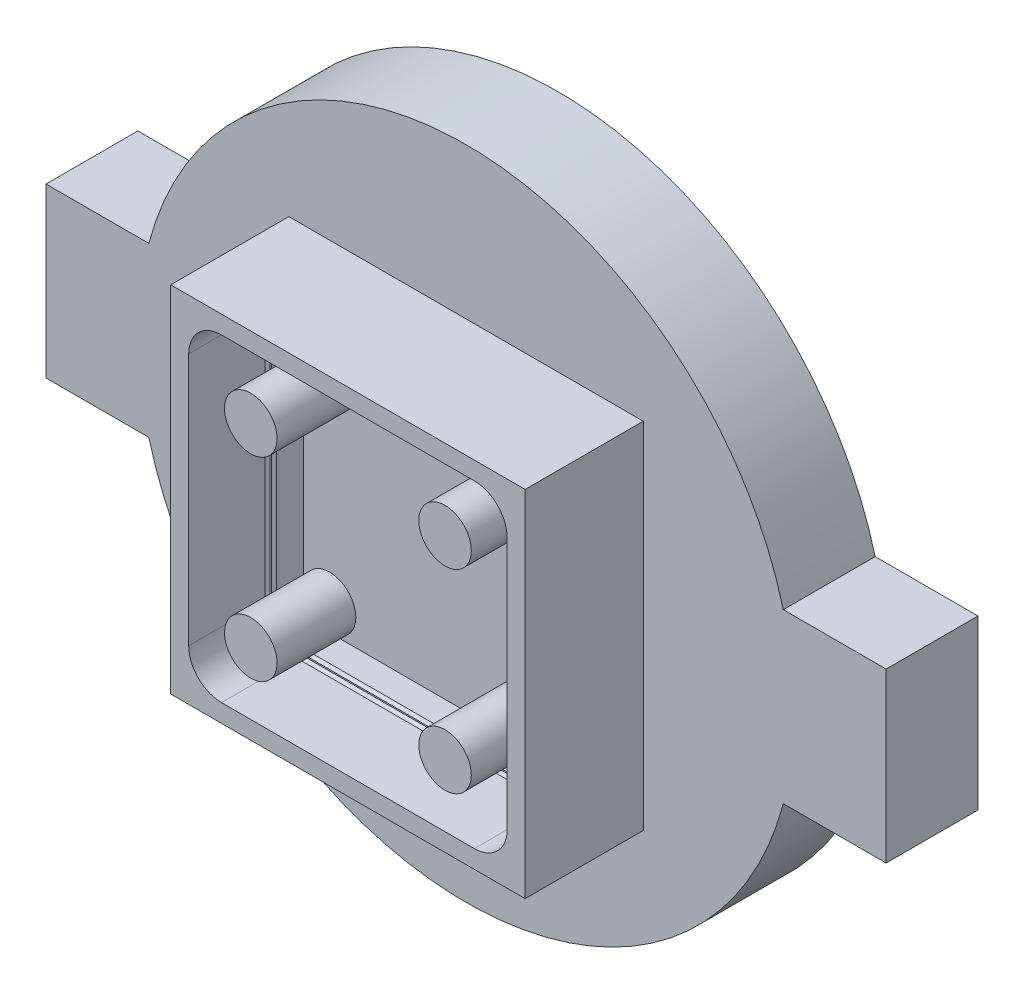
from build123d import *

# Parameters (mm, degrees)
SKETCH1_R           = 17.5
BOSS_EXTRUDE1_DEPTH = 3
SKETCH2_R           = 17.5
BOSS_EXTRUDE2_DEPTH = 0.5
SKETCH3_W           = 13.5
SKETCH3_H           = 13.5
SKETCH3_W_2         = 11.63
SKETCH3_H_2         = 11.63
SKETCH3_W_3         = 9.4
SKETCH3_H_3         = 9.4
BOSS_EXTRUDE3_DEPTH = 1.5
FILLET1_R           = 1
SKETCH4_R           = 17.5
CUT_EXTRUDE1_DEPTH  = 32.5
BOSS_EXTRUDE4_START = 3
SKETCH5_R           = 1
BOSS_EXTRUDE4_DEPTH = 3
SKETCH6_W           = 13.5
SKETCH6_H           = 13.5
BOSS_EXTRUDE6_DEPTH = 3
CHAMFER1_SIZE       = 0.1


with BuildPart() as part:
    # Sketch1 → Boss-Extrude1 (new body)
    with BuildSketch(Plane.XY):
        Circle(SKETCH1_R)
        with BuildLine():
            Line((-9.921567416, -1.25), (-14.021567416, -1.25))
            Line((-14.021567416, -1.25), (-14.021567416, 1.25))
            Line((-14.021567416, 1.25), (-9.921567416, 1.25))
            ThreePointArc((-9.921567416, 1.25), (0, 10), (9.921567416, 1.25))
            Line((9.921567416, 1.25), (14.021567416, 1.25))
            Line((14.021567416, 1.25), (14.021567416, -1.25))
            Line((14.021567416, -1.25), (9.921567416, -1.25))
            ThreePointArc((9.921567416, -1.25), (0, -10), (-9.921567416, -1.25))
        make_face(mode=Mode.SUBTRACT)
    extrude(amount=BOSS_EXTRUDE1_DEPTH)

    # Sketch2 → Boss-Extrude2 (add)
    with BuildSketch(Plane.XY.offset(3)):
        Circle(SKETCH2_R)
    extrude(amount=BOSS_EXTRUDE2_DEPTH)

    # Sketch3 → Boss-Extrude3 (add)
    # profile 1 of 2: a face of its own
    with BuildSketch(Plane.XY.offset(3.5)):
        Rectangle(SKETCH3_W, SKETCH3_H)
        Rectangle(SKETCH3_W_2, SKETCH3_H_2, mode=Mode.SUBTRACT)
    # profile 2 of 2: a face of its own
    with BuildSketch(Plane.XY.offset(3.5)):
        Rectangle(SKETCH3_W_3, SKETCH3_H_3)
    extrude(amount=BOSS_EXTRUDE3_DEPTH)

    # Fillet1
    fillet1_edges = [part.edges().sort_by_distance(p)[0] for p in [
        (4.7, 4.7, 4.25),
        (-4.7, 4.7, 4.25),
        (-4.7, -4.7, 4.25),
        (4.7, -4.7, 4.25),
        (5.815, -5.815, 4.25),
        (-5.815, -5.815, 4.25),
        (-5.815, 5.815, 4.25),
        (5.815, 5.815, 4.25),
    ]]
    fillet(fillet1_edges, radius=FILLET1_R)

    # Sketch4 → Cut-Extrude1 (cut)
    with BuildSketch(Plane(origin=(0, 0, 0), x_dir=(-1, 0, 0), z_dir=(0, 0, -1))):
        Circle(SKETCH4_R)
        with BuildLine():
            Line((-16, 3.2), (-16, -3.2))
            Line((-16, -3.2), (-12.083459769, -3.2))
            ThreePointArc((-12.083459769, -3.2), (0, -12.5), (12.083459769, -3.2))
            Line((12.083459769, -3.2), (16, -3.2))
            Line((16, -3.2), (16, 3.2))
            Line((16, 3.2), (12.083459769, 3.2))
            ThreePointArc((12.083459769, 3.2), (0, 12.5), (-12.083459769, 3.2))
            Line((-12.083459769, 3.2), (-16, 3.2))
        make_face(mode=Mode.SUBTRACT)
    extrude(amount=-CUT_EXTRUDE1_DEPTH, mode=Mode.SUBTRACT)

    # Sketch5 → Boss-Extrude4 (add)
    with BuildSketch(Plane.XY.offset(5).offset(BOSS_EXTRUDE4_START)):
        with Locations(Location((-3.7, 3.7, 0), (0, 0, 180))):
            Circle(SKETCH5_R)
        with Locations((3.7, 3.7)):
            Circle(SKETCH5_R)
        with Locations((3.7, -3.7)):
            Circle(SKETCH5_R)
        with Locations((-3.7, -3.7)):
            Circle(SKETCH5_R)
    extrude(amount=-BOSS_EXTRUDE4_DEPTH)

    # Sketch6 → Boss-Extrude6 (add)
    with BuildSketch(Plane.XY.offset(8)):
        Rectangle(SKETCH6_W, SKETCH6_H)
        with BuildLine():
            Line((-6.065, 4.815), (-6.065, -4.815))
            ThreePointArc((-6.065, -4.815), (-5.698883476, -5.698883476), (-4.815, -6.065))
            Line((-4.815, -6.065), (4.815, -6.065))
            ThreePointArc((4.815, -6.065), (5.698883476, -5.698883476), (6.065, -4.815))
            Line((6.065, -4.815), (6.065, 4.815))
            ThreePointArc((6.065, 4.815), (5.698883476, 5.698883476), (4.815, 6.065))
            Line((4.815, 6.065), (-4.815, 6.065))
            ThreePointArc((-4.815, 6.065), (-5.698883476, 5.698883476), (-6.065, 4.815))
        make_face(mode=Mode.SUBTRACT)
    extrude(amount=-BOSS_EXTRUDE6_DEPTH)

    # Chamfer1
    chamfer1_edges = [part.edges().sort_by_distance(p)[0] for p in [
        (-5.522106781, -5.522106781, 5),
        (5.522106781, 5.522106781, 5),
        (-5.522106781, 5.522106781, 5),
        (5.522106781, -5.522106781, 5),
        (-6.065, 0, 5),
        (-5.698883476, -5.698883476, 5),
        (0, -6.065, 5),
        (5.698883476, -5.698883476, 5),
        (6.065, 0, 5),
        (5.698883476, 5.698883476, 5),
        (0, 6.065, 5),
        (-5.698883476, 5.698883476, 5),
        (-5.815, 0, 5),
        (0, -5.815, 5),
        (5.815, 0, 5),
        (0, 5.815, 5),
    ]]
    chamfer(chamfer1_edges, length=CHAMFER1_SIZE)


solid = part.part
